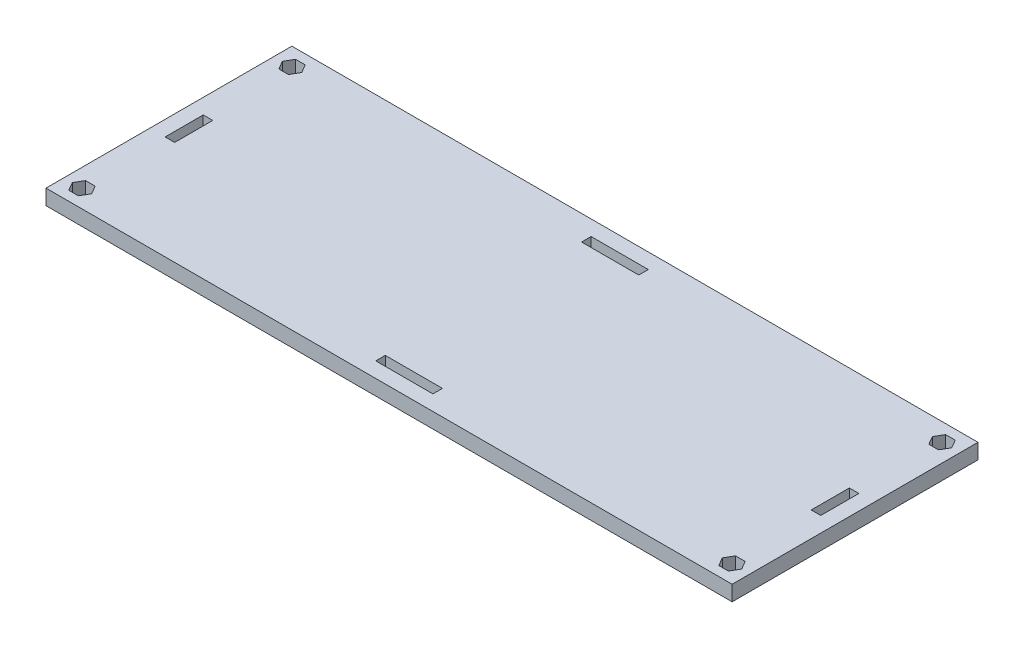
from build123d import *

# Parameters (mm, degrees)
CROQUIS1_W              = 180
CROQUIS1_H              = 64.5
SALIENTE_EXTRUIR1_DEPTH = 4
CROQUIS2_W              = 2.5
CROQUIS2_H              = 10
CORTAR_EXTRUIR1_DEPTH   = 4
MATRIZL1_COUNT          = 2
MATRIZL1_PITCH          = 169.5
CROQUIS3_W              = 15
CROQUIS3_H              = 2.5
CORTAR_EXTRUIR2_DEPTH   = 4
CORTAR_EXTRUIR3_DEPTH   = 4
MATRIZL2_COUNT          = 2
MATRIZL2_PITCH          = 170.52
MATRIZL2_COUNT_DIR2     = 2
MATRIZL2_PITCH_DIR2     = 55.1


with BuildPart() as part:
    # Croquis1 → Saliente-Extruir1 (new body)
    with BuildSketch(Plane(origin=(0, 0, 0), x_dir=(1, 0, 0), z_dir=(0, 1, 0))):
        Rectangle(CROQUIS1_W, CROQUIS1_H)
    extrude(amount=SALIENTE_EXTRUIR1_DEPTH)

    # Croquis2 → Cortar-Extruir1 (cut)
    with BuildSketch(Plane(origin=(0, 4, 0), x_dir=(1, 0, 0), z_dir=(0, 1, 0))):
        with Locations((84.75, 0)):
            Rectangle(CROQUIS2_W, CROQUIS2_H)
    cortar_extruir1 = extrude(amount=-CORTAR_EXTRUIR1_DEPTH, mode=Mode.SUBTRACT)

    # MatrizL1: Cortar-Extruir1 ×2
    with Locations(*[(-i * MATRIZL1_PITCH, 0, 0) for i in range(1, MATRIZL1_COUNT)]):
        add(cortar_extruir1, mode=Mode.SUBTRACT)

    # Croquis3 → Cortar-Extruir2 (cut)
    with BuildSketch(Plane(origin=(0, 0, 0), x_dir=(1, 0, 0), z_dir=(0, 1, 0))):
        with Locations((0, 27)):
            Rectangle(CROQUIS3_W, CROQUIS3_H)
        with Locations((0, -27)):
            Rectangle(CROQUIS3_W, CROQUIS3_H)
    extrude(amount=CORTAR_EXTRUIR2_DEPTH, mode=Mode.SUBTRACT)

    # Croquis4 → Cortar-Extruir3 (cut)
    with BuildSketch(Plane(origin=(0, 4, 0), x_dir=(1, 0, 0), z_dir=(0, 1, 0))):
        Polygon((-82.719317631, 27.55), (-83.989488223, 29.75), (-86.529829408, 29.75), (-87.8, 27.55), (-86.529829408, 25.35), (-83.989488223, 25.35), align=None)
    cortar_extruir3 = extrude(amount=-CORTAR_EXTRUIR3_DEPTH, mode=Mode.SUBTRACT)

    # MatrizL2: Cortar-Extruir3 2 × 2
    with Locations(*[(i * MATRIZL2_PITCH, 0, j * MATRIZL2_PITCH_DIR2) for i in range(MATRIZL2_COUNT) for j in range(MATRIZL2_COUNT_DIR2) if (i, j) != (0, 0)]):
        add(cortar_extruir3, mode=Mode.SUBTRACT)


solid = part.part
